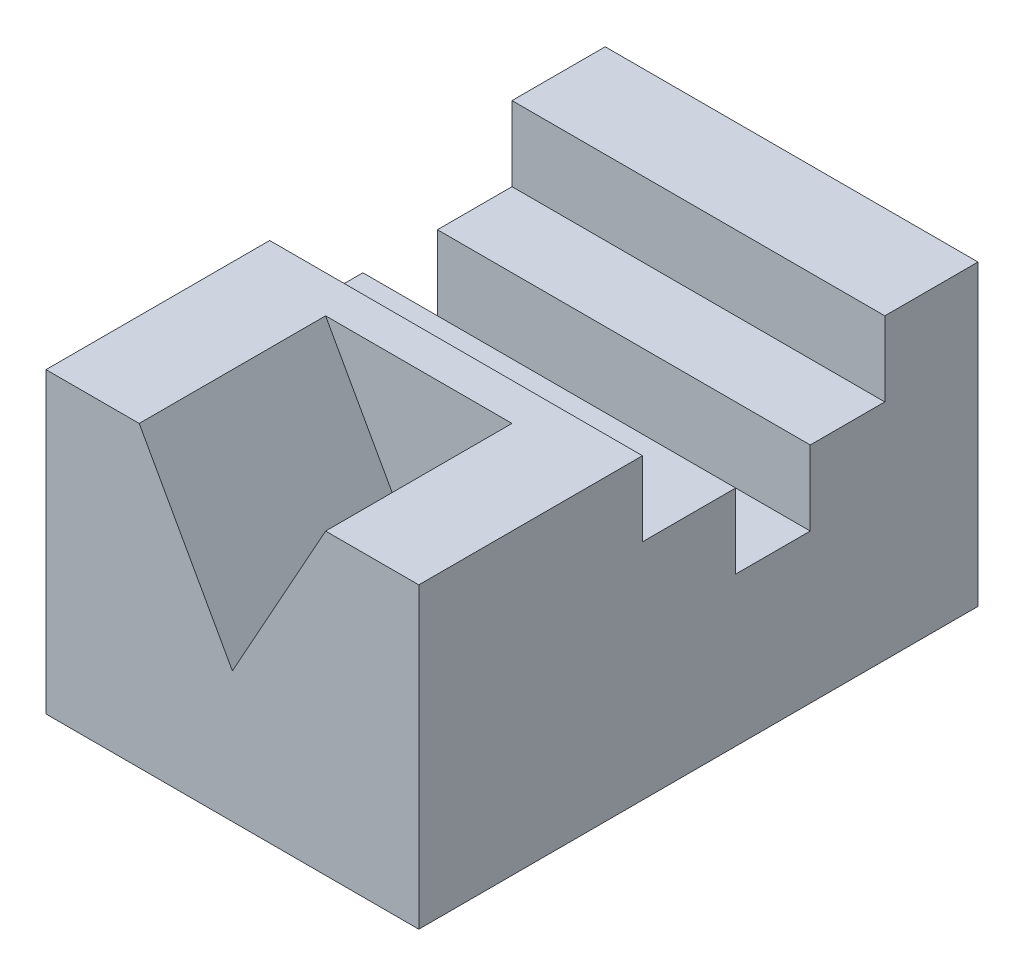
from build123d import *

# Parameters (mm, degrees)
SKETCH1_W           = 100
SKETCH1_H           = 150
BOSS_EXTRUDE1_DEPTH = 80
SKETCH2_OUTSIDE_W   = 141.446
SKETCH2_OUTSIDE_H   = 121.446
CUT_EXTRUDE2_DEPTH  = 50
SKETCH4_OUTSIDE_W   = 191.446
SKETCH4_OUTSIDE_H   = 121.446
CUT_EXTRUDE3_DEPTH  = 100


with BuildPart() as part:
    # Sketch1 → Boss-Extrude1 (new body)
    with BuildSketch(Plane(origin=(0, 0, 0), x_dir=(1, 0, 0), z_dir=(0, 1, 0))):
        Rectangle(SKETCH1_W, SKETCH1_H)
    extrude(amount=BOSS_EXTRUDE1_DEPTH)

    # Sketch2 outside → Cut-Extrude2 (cut)
    with BuildSketch(Plane.XY.offset(75)):
        with Locations((0, 40)):
            Rectangle(SKETCH2_OUTSIDE_W, SKETCH2_OUTSIDE_H)
        Polygon((50, 0), (-50, 0), (-50, 80), (-25, 80), (0, 35), (25, 80), (50, 80), align=None, mode=Mode.SUBTRACT)
    extrude(amount=-CUT_EXTRUDE2_DEPTH, mode=Mode.SUBTRACT)

    # Sketch4 outside → Cut-Extrude3 (cut)
    with BuildSketch(Plane.ZY.offset(50)):
        with Locations((0, 40)):
            Rectangle(SKETCH4_OUTSIDE_W, SKETCH4_OUTSIDE_H)
        Polygon((-75, 80), (-50, 80), (-50, 60), (-30, 60), (-30, 40), (-10, 40), (-10, 60), (15, 60), (15, 80), (75, 80), (75, 0), (-75, 0), align=None, mode=Mode.SUBTRACT)
    extrude(amount=-CUT_EXTRUDE3_DEPTH, mode=Mode.SUBTRACT)


solid = part.part
